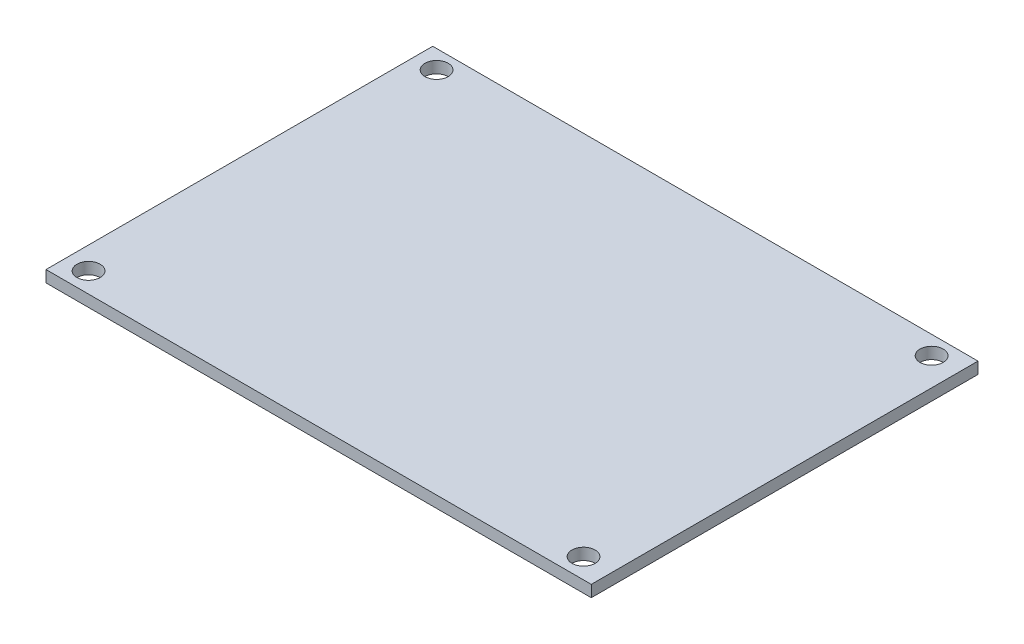
from build123d import *

# Parameters (mm, degrees)
ESQUISSE1_W        = 70.5
ESQUISSE1_H        = 50
ESQUISSE1_R        = 1.5
BOSS_EXTRU_1_DEPTH = 1.5


with BuildPart() as part:
    # Esquisse1 → Boss.-Extru.1 (new body)
    with BuildSketch(Plane(origin=(0, 0, 0), x_dir=(1, 0, 0), z_dir=(0, 1, 0))):
        Rectangle(ESQUISSE1_W, ESQUISSE1_H)
        with Locations(Location((-32.35, 22.6, 0), (0, 0, 270))):
            Circle(ESQUISSE1_R, mode=Mode.SUBTRACT)
        with Locations(Location((-32.35, -22.4, 0), (0, 0, 270))):
            Circle(ESQUISSE1_R, mode=Mode.SUBTRACT)
        with Locations(Location((31.65, 22.6, 0), (0, 0, 270))):
            Circle(ESQUISSE1_R, mode=Mode.SUBTRACT)
        with Locations(Location((31.65, -22.4, 0), (0, 0, 270))):
            Circle(ESQUISSE1_R, mode=Mode.SUBTRACT)
    extrude(amount=BOSS_EXTRU_1_DEPTH)


solid = part.part
